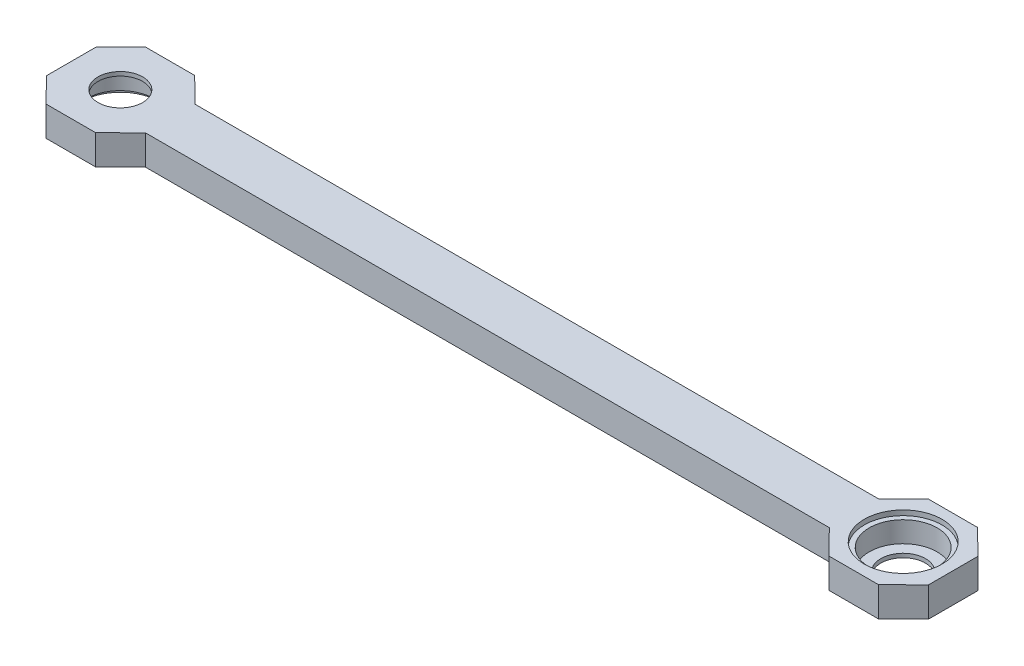
from build123d import *

# Parameters (mm, degrees)
SKETCH_1_R          = 4.5
EXTRUDE_1_DEPTH     = 6
SKETCH_2_R          = 6.85
CUT_EXTRUDE_1_DEPTH = 5.2
SKETCH_3_R          = 7.85
CUT_EXTRUDE_2_DEPTH = 1
SKETCH_5_R          = 6.85
CUT_EXTRUDE_3_DEPTH = 5.2
SKETCH_6_R          = 7.85
CUT_EXTRUDE_4_DEPTH = 1


with BuildPart() as part:
    # 草图1 → 凸台-拉伸1 (new body)
    with BuildSketch(Plane(origin=(0, 0, 0), x_dir=(1, 0, 0), z_dir=(0, 1, 0))):
        Polygon((-65.26232397, 5), (-70.363344484, 10), (-80.363344484, 10), (-85.26232397, 5), (-85.26232397, -5), (-80.363344484, -10), (-70.363344484, -10), (-65.26232397, -5), (72.73767603, -5), (77.636655516, -10), (87.636655516, -10), (92.739759147, -5), (92.739759147, 5), (87.636655516, 10), (77.636655516, 10), (72.73767603, 5), align=None)
        with Locations(Location((-75.363344484, 0, 0), (0, 0, 270))):
            Circle(SKETCH_1_R, mode=Mode.SUBTRACT)
        with Locations(Location((82.636655516, 0, 0), (0, 0, 270))):
            Circle(SKETCH_1_R, mode=Mode.SUBTRACT)
    extrude(amount=EXTRUDE_1_DEPTH)

    # 草图2 → 切除-拉伸1 (cut)
    with BuildSketch(Plane(origin=(0, 6, 0), x_dir=(1, 0, 0), z_dir=(0, 1, 0))):
        with Locations(Location((82.636655516, 0, 0), (0, 0, 270))):
            Circle(SKETCH_2_R)
    extrude(amount=-CUT_EXTRUDE_1_DEPTH, mode=Mode.SUBTRACT)

    # 草图3 → 切除-拉伸2 (cut)
    with BuildSketch(Plane(origin=(0, 6, 0), x_dir=(1, 0, 0), z_dir=(0, 1, 0))):
        with Locations(Location((82.636655516, 0, 0), (0, 0, 270))):
            Circle(SKETCH_3_R)
    extrude(amount=-CUT_EXTRUDE_2_DEPTH, mode=Mode.SUBTRACT)

    # 草图5 → 切除-拉伸3 (cut)
    with BuildSketch(Plane.XZ):
        with Locations(Location((-75.363344484, 0, 0), (0, 0, 270))):
            Circle(SKETCH_5_R)
    extrude(amount=-CUT_EXTRUDE_3_DEPTH, mode=Mode.SUBTRACT)

    # 草图6 → 切除-拉伸4 (cut)
    with BuildSketch(Plane.XZ):
        with Locations(Location((-75.363344484, 0, 0), (0, 0, 270))):
            Circle(SKETCH_6_R)
    extrude(amount=-CUT_EXTRUDE_4_DEPTH, mode=Mode.SUBTRACT)


solid = part.part
